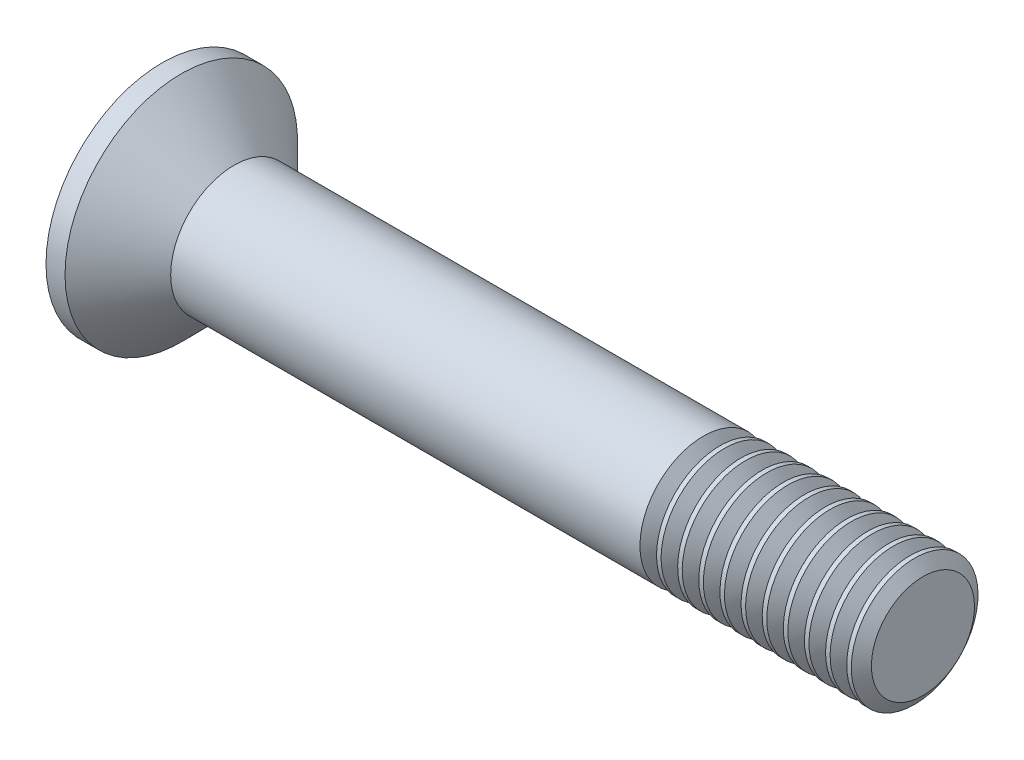
from build123d import *

# Parameters (mm, degrees)
CIRPATTERN1_COUNT = 2
CIRPATTERN1_ANGLE = 90
THDSCHPAT_COUNT   = 11
THDSCHPAT_PITCH   = 0.5


with BuildPart() as part:
    # BodySke → Base-Revolve (revolve)
    with BuildSketch(Plane.XY, mode=Mode.PRIVATE) as base_revolve_sk:
        Polygon((0, 0), (0, 2.75), (0.45, 2.75), (1.7, 1.5), (18, 1.5), (18, 0), align=None)
    revolve(base_revolve_sk.sketch.rotate(Axis((-6.35, 0, 0), (1, 0, 0)), 90), axis=Axis((-6.35, 0, 0), (1, 0, 0)))

    # Sketch3 → Cross section 0
    with BuildSketch(Plane.ZY):
        with BuildLine():
            Line((-0.395, 1.55), (0.395, 1.55))
            Line((0.395, 1.55), (0.395, -1.55))
            Line((0.395, -1.55), (-0.395, -1.55))
            Line((-0.395, -1.55), (-0.395, 1.55))
        make_face()
    # Sketch4 → Cross section 1
    with BuildSketch(Plane.ZY.offset(-2.08)):
        with BuildLine():
            Line((-0.1975, 0.1975), (0.1975, 0.1975))
            Line((0.1975, 0.1975), (0.1975, -0.1975))
            Line((0.1975, -0.1975), (-0.1975, -0.1975))
            Line((-0.1975, -0.1975), (-0.1975, 0.1975))
        make_face()
    cross = loft(mode=Mode.SUBTRACT)

    # CirPattern1: Cross ×2 about axis
    cirpattern1_axis = Axis((0, 0, 0), (1, 0, 0))
    for i in range(1, CIRPATTERN1_COUNT):
        add(cross.rotate(cirpattern1_axis, i * CIRPATTERN1_ANGLE / (CIRPATTERN1_COUNT - 1)), mode=Mode.SUBTRACT)

    # ThdSchSke → ThreadSchematic (revolve, cut)
    with BuildSketch(Plane.XY):
        Polygon((13.000001, -1.2195), (12.803592786, -1.5), (12.803592786, -1.875), (13.196409214, -1.875), (13.196409214, -1.5), align=None)
    threadschematic = revolve(axis=Axis((-3.175, 0, 0), (1, 0, 0)), mode=Mode.SUBTRACT)

    # ThdSchPat: ThreadSchematic ×11
    with Locations(*[(i * THDSCHPAT_PITCH, 0, 0) for i in range(1, THDSCHPAT_COUNT)]):
        add(threadschematic, mode=Mode.SUBTRACT)


solid = part.part
